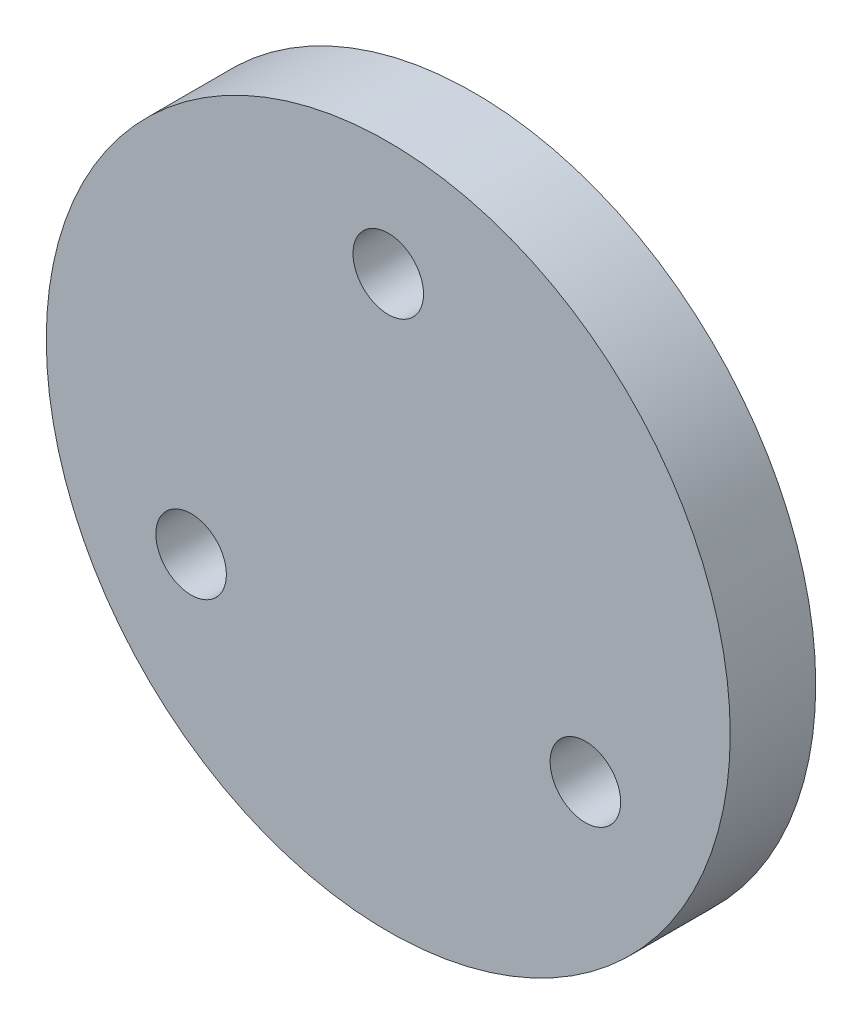
from build123d import *

# Parameters (mm, degrees)
SKETCH1_R           = 16
SKETCH1_R_2         = 1.65
BOSS_EXTRUDE1_DEPTH = 4


with BuildPart() as part:
    # Sketch1 → Boss-Extrude1 (new body)
    with BuildSketch(Plane.XY):
        Circle(SKETCH1_R)
        with Locations((9.22317055, -5.325)):
            Circle(SKETCH1_R_2, mode=Mode.SUBTRACT)
        with Locations((0, 10.65)):
            Circle(SKETCH1_R_2, mode=Mode.SUBTRACT)
        with Locations((-9.22317055, -5.325)):
            Circle(SKETCH1_R_2, mode=Mode.SUBTRACT)
    extrude(amount=BOSS_EXTRUDE1_DEPTH)


solid = part.part
